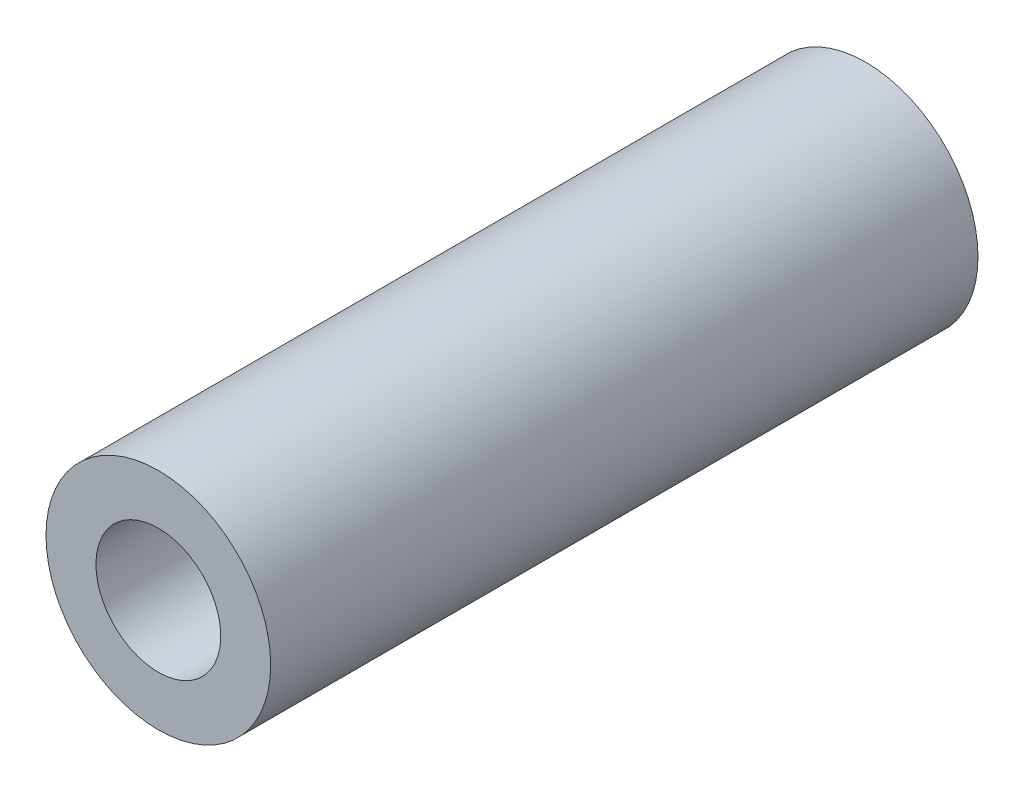
from build123d import *

# Parameters (mm, degrees)
SKETCH5_W = 107.95
SKETCH5_H = 7.62


with BuildPart() as part:
    # Sketch5 → Revolve1 (revolve)
    with BuildSketch(Plane(origin=(0, 0, 0), x_dir=(0, 0, -1), z_dir=(1, 0, 0)), mode=Mode.PRIVATE) as revolve1_sk:
        with Locations((0, 13.335)):
            Rectangle(SKETCH5_W, SKETCH5_H)
    revolve(revolve1_sk.sketch.rotate(Axis((0, 0, -53.975), (0, 0, 1)), 90), axis=Axis((0, 0, -53.975), (0, 0, 1)))


solid = part.part
